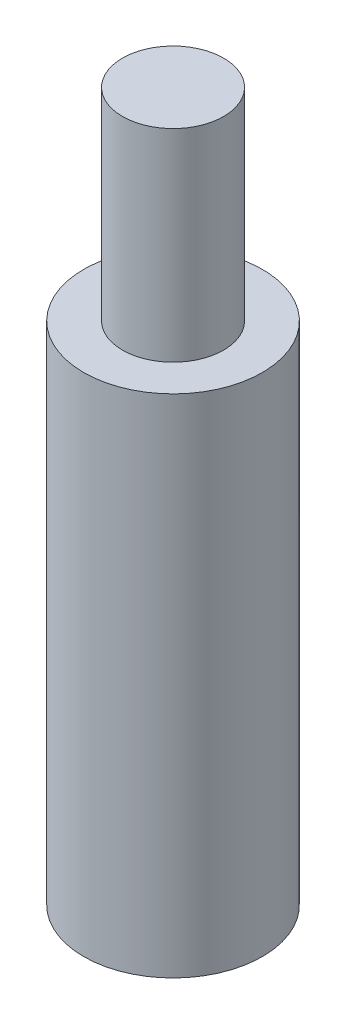
from build123d import *

# Parameters (mm, degrees)
SKETCH1_R           = 2.65
BOSS_EXTRUDE1_DEPTH = 15
SKETCH2_R           = 1.5
BOSS_EXTRUDE2_DEPTH = 6
SKETCH3_R           = 1.5
CUT_EXTRUDE1_DEPTH  = 10


with BuildPart() as part:
    # Sketch1 → Boss-Extrude1 (new body)
    with BuildSketch(Plane(origin=(0, 0, 0), x_dir=(1, 0, 0), z_dir=(0, 1, 0))):
        with Locations(Location((0, 0, 0), (0, 0, 270))):
            Circle(SKETCH1_R)
    extrude(amount=BOSS_EXTRUDE1_DEPTH)

    # Sketch2 → Boss-Extrude2 (add)
    with BuildSketch(Plane(origin=(0, 15, 0), x_dir=(1, 0, 0), z_dir=(0, 1, 0))):
        with Locations(Location((0, 0, 0), (0, 0, 270))):
            Circle(SKETCH2_R)
    extrude(amount=BOSS_EXTRUDE2_DEPTH)

    # Sketch3 → Cut-Extrude1 (cut)
    with BuildSketch(Plane.XZ):
        with Locations(Location((0, 0, 0), (0, 0, 90))):
            Circle(SKETCH3_R)
    extrude(amount=-CUT_EXTRUDE1_DEPTH, mode=Mode.SUBTRACT)


solid = part.part
